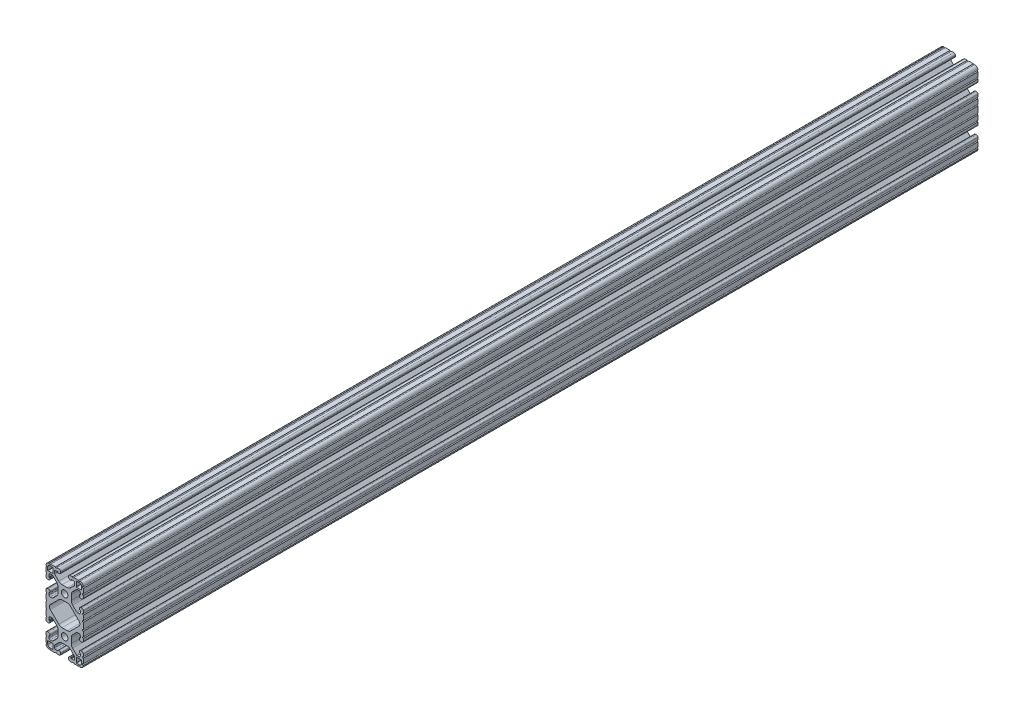
from build123d import *

# Parameters (mm, degrees)
SKETCH1_R           = 3.3274
BOSS_EXTRUDE1_DEPTH = 914.4


with BuildPart() as part:
    # Sketch1 → Boss-Extrude1 (new body)
    with BuildSketch(Plane(origin=(0, 0, -914.4), x_dir=(-1, 0, 0), z_dir=(0, 0, -1))):
        with BuildLine():
            Line((19.05, -14.3256), (19.05, -9.4996))
            ThreePointArc((19.05, -9.4996), (18.288, -8.7376), (19.05, -7.9756))
            Line((19.05, -7.9756), (19.05, -5.6388))
            ThreePointArc((19.05, -5.6388), (18.588751759, -4.525248241), (17.4752, -4.064))
            Line((17.4752, -4.064), (16.5608, -4.064))
            ThreePointArc((16.5608, -4.064), (15.447248241, -4.525248241), (14.986, -5.6388))
            Line((14.986, -5.6388), (14.986, -6.35))
            ThreePointArc((14.986, -6.35), (15.060394878, -6.529605122), (15.24, -6.604))
            Line((15.24, -6.604), (15.7099, -6.604))
            ThreePointArc((15.7099, -6.604), (15.889505122, -6.678394878), (15.9639, -6.858))
            Line((15.9639, -6.858), (15.9639, -9.017))
            ThreePointArc((15.9639, -9.017), (15.591925612, -9.915025612), (14.6939, -10.287))
            Line((14.6939, -10.287), (12.968312693, -10.287))
            ThreePointArc((12.968312693, -10.287), (12.482304734, -10.190327006), (12.070287081, -9.915025612))
            Line((12.070287081, -9.915025612), (8.147584211, -5.992322742))
            ThreePointArc((8.147584211, -5.992322742), (7.117956996, -4.451376719), (6.7564, -2.633706952))
            Line((6.7564, -2.633706952), (6.7564, 2.633706952))
            ThreePointArc((6.7564, 2.633706952), (7.117956996, 4.451376719), (8.147584211, 5.992322742))
            Line((8.147584211, 5.992322742), (12.070287081, 9.915025612))
            ThreePointArc((12.070287081, 9.915025612), (12.482304734, 10.190327006), (12.968312693, 10.287))
            Line((12.968312693, 10.287), (14.6939, 10.287))
            ThreePointArc((14.6939, 10.287), (15.591925612, 9.915025612), (15.9639, 9.017))
            Line((15.9639, 9.017), (15.9639, 6.858))
            ThreePointArc((15.9639, 6.858), (15.889505122, 6.678394878), (15.7099, 6.604))
            Line((15.7099, 6.604), (15.24, 6.604))
            ThreePointArc((15.24, 6.604), (15.060394878, 6.529605122), (14.986, 6.35))
            Line((14.986, 6.35), (14.986, 5.6388))
            ThreePointArc((14.986, 5.6388), (15.447248241, 4.525248241), (16.5608, 4.064))
            Line((16.5608, 4.064), (17.4752, 4.064))
            ThreePointArc((17.4752, 4.064), (18.588751759, 4.525248241), (19.05, 5.6388))
            Line((19.05, 5.6388), (19.05, 7.9756))
            ThreePointArc((19.05, 7.9756), (18.288, 8.7376), (19.05, 9.4996))
            Line((19.05, 9.4996), (19.05, 14.3256))
            ThreePointArc((19.05, 14.3256), (18.288, 15.0876), (19.05, 15.8496))
            Line((19.05, 15.8496), (19.05, 22.2504))
            ThreePointArc((19.05, 22.2504), (18.288, 23.0124), (19.05, 23.7744))
            Line((19.05, 23.7744), (19.05, 28.6004))
            ThreePointArc((19.05, 28.6004), (18.288, 29.3624), (19.05, 30.1244))
            Line((19.05, 30.1244), (19.05, 32.4612))
            ThreePointArc((19.05, 32.4612), (18.588751759, 33.574751759), (17.4752, 34.036))
            Line((17.4752, 34.036), (16.5608, 34.036))
            ThreePointArc((16.5608, 34.036), (15.447248241, 33.574751759), (14.986, 32.4612))
            Line((14.986, 32.4612), (14.986, 31.75))
            ThreePointArc((14.986, 31.75), (15.060394878, 31.570394878), (15.24, 31.496))
            Line((15.24, 31.496), (15.7099, 31.496))
            ThreePointArc((15.7099, 31.496), (15.889505122, 31.421605122), (15.9639, 31.242))
            Line((15.9639, 31.242), (15.9639, 29.083))
            ThreePointArc((15.9639, 29.083), (15.591925612, 28.184974388), (14.6939, 27.813))
            Line((14.6939, 27.813), (12.968312693, 27.813))
            ThreePointArc((12.968312693, 27.813), (12.482304734, 27.909672994), (12.070287081, 28.184974388))
            Line((12.070287081, 28.184974388), (8.147584211, 32.107677258))
            ThreePointArc((8.147584211, 32.107677258), (7.117956996, 33.648623281), (6.7564, 35.466293048))
            Line((6.7564, 35.466293048), (6.7564, 40.733706952))
            ThreePointArc((6.7564, 40.733706952), (7.117956996, 42.551376719), (8.147584211, 44.092322742))
            Line((8.147584211, 44.092322742), (12.070287081, 48.015025612))
            ThreePointArc((12.070287081, 48.015025612), (12.482304734, 48.290327006), (12.968312693, 48.387))
            Line((12.968312693, 48.387), (14.6939, 48.387))
            ThreePointArc((14.6939, 48.387), (15.591925612, 48.015025612), (15.9639, 47.117))
            Line((15.9639, 47.117), (15.9639, 44.958))
            ThreePointArc((15.9639, 44.958), (15.889505122, 44.778394878), (15.7099, 44.704))
            Line((15.7099, 44.704), (15.24, 44.704))
            ThreePointArc((15.24, 44.704), (15.060394878, 44.629605122), (14.986, 44.45))
            Line((14.986, 44.45), (14.986, 43.7388))
            ThreePointArc((14.986, 43.7388), (15.447248241, 42.625248241), (16.5608, 42.164))
            Line((16.5608, 42.164), (17.4752, 42.164))
            ThreePointArc((17.4752, 42.164), (18.588751759, 42.625248241), (19.05, 43.7388))
            Line((19.05, 43.7388), (19.05, 46.0756))
            ThreePointArc((19.05, 46.0756), (18.288, 46.8376), (19.05, 47.5996))
            Line((19.05, 47.5996), (19.05, 52.425599983))
            ThreePointArc((19.05, 52.425599983), (18.287999983, 53.187599965), (19.04999993, 53.949600017))
            ThreePointArc((19.04999993, 53.949600017), (18.120166371, 56.220166482), (15.849599896, 57.150000017))
            ThreePointArc((15.849599896, 57.150000017), (15.087599913, 56.388000034), (14.32559993, 57.150000017))
            Line((14.32559993, 57.150000017), (9.499599913, 57.150000017))
            ThreePointArc((9.499599913, 57.150000017), (8.737599913, 56.388000017), (7.975599913, 57.150000017))
            Line((7.975599913, 57.150000017), (5.638799984, 57.150000017))
            ThreePointArc((5.638799984, 57.150000017), (4.525248225, 56.688751776), (4.063999984, 55.575200017))
            Line((4.063999984, 55.575200017), (4.063999984, 54.6608))
            ThreePointArc((4.063999984, 54.6608), (4.525248225, 53.547248241), (5.638799984, 53.086))
            Line((5.638799984, 53.086), (6.35, 53.086))
            ThreePointArc((6.35, 53.086), (6.529605122, 53.160394878), (6.604, 53.34))
            Line((6.604, 53.34), (6.604, 53.8099))
            ThreePointArc((6.604, 53.8099), (6.678394878, 53.989505122), (6.858, 54.0639))
            Line((6.858, 54.0639), (9.017, 54.0639))
            ThreePointArc((9.017, 54.0639), (9.915025612, 53.691925612), (10.287, 52.7939))
            Line((10.287, 52.7939), (10.287, 51.068312693))
            ThreePointArc((10.287, 51.068312693), (10.190327006, 50.582304734), (9.915025612, 50.170287081))
            Line((9.915025612, 50.170287081), (5.992322742, 46.247584211))
            ThreePointArc((5.992322742, 46.247584211), (4.451376719, 45.217956996), (2.633706952, 44.8564))
            Line((2.633706952, 44.8564), (-2.633706952, 44.8564))
            ThreePointArc((-2.633706952, 44.8564), (-4.451376719, 45.217956996), (-5.992322742, 46.247584211))
            Line((-5.992322742, 46.247584211), (-9.915025612, 50.170287081))
            ThreePointArc((-9.915025612, 50.170287081), (-10.190327006, 50.582304734), (-10.287, 51.068312693))
            Line((-10.287, 51.068312693), (-10.287, 52.7939))
            ThreePointArc((-10.287, 52.7939), (-9.915025612, 53.691925612), (-9.017, 54.0639))
            Line((-9.017, 54.0639), (-6.858, 54.0639))
            ThreePointArc((-6.858, 54.0639), (-6.678394878, 53.989505122), (-6.604, 53.8099))
            Line((-6.604, 53.8099), (-6.604, 53.34))
            ThreePointArc((-6.604, 53.34), (-6.529605122, 53.160394878), (-6.35, 53.086))
            Line((-6.35, 53.086), (-5.638800016, 53.086))
            ThreePointArc((-5.638800016, 53.086), (-4.525248257, 53.547248241), (-4.064000016, 54.6608))
            Line((-4.064000016, 54.6608), (-4.064000016, 55.575200017))
            ThreePointArc((-4.064000016, 55.575200017), (-4.525248257, 56.688751776), (-5.638800016, 57.150000017))
            Line((-5.638800016, 57.150000017), (-7.975600087, 57.150000017))
            ThreePointArc((-7.975600087, 57.150000017), (-8.737600087, 56.388000017), (-9.499600087, 57.150000017))
            Line((-9.499600087, 57.150000017), (-14.325600087, 57.150000017))
            ThreePointArc((-14.325600087, 57.150000017), (-15.087600087, 56.388000017), (-15.849600087, 57.150000017))
            ThreePointArc((-15.849600087, 57.150000017), (-18.120166552, 56.220166458), (-19.050000087, 53.949599983))
            ThreePointArc((-19.050000087, 53.949599983), (-18.288000017, 53.187600043), (-19.05, 52.425600017))
            Line((-19.05, 52.425600017), (-19.05, 47.5996))
            ThreePointArc((-19.05, 47.5996), (-18.288, 46.8376), (-19.05, 46.0756))
            Line((-19.05, 46.0756), (-19.05, 43.7388))
            ThreePointArc((-19.05, 43.7388), (-18.588751759, 42.625248241), (-17.4752, 42.164))
            Line((-17.4752, 42.164), (-16.5608, 42.164))
            ThreePointArc((-16.5608, 42.164), (-15.447248241, 42.625248241), (-14.986, 43.7388))
            Line((-14.986, 43.7388), (-14.986, 44.45))
            ThreePointArc((-14.986, 44.45), (-15.060394878, 44.629605122), (-15.24, 44.704))
            Line((-15.24, 44.704), (-15.7099, 44.704))
            ThreePointArc((-15.7099, 44.704), (-15.889505122, 44.778394878), (-15.9639, 44.958))
            Line((-15.9639, 44.958), (-15.9639, 47.117))
            ThreePointArc((-15.9639, 47.117), (-15.591925612, 48.015025612), (-14.6939, 48.387))
            Line((-14.6939, 48.387), (-12.968312693, 48.387))
            ThreePointArc((-12.968312693, 48.387), (-12.482304734, 48.290327006), (-12.070287081, 48.015025612))
            Line((-12.070287081, 48.015025612), (-8.147584211, 44.092322742))
            ThreePointArc((-8.147584211, 44.092322742), (-7.117956996, 42.551376719), (-6.7564, 40.733706952))
            Line((-6.7564, 40.733706952), (-6.7564, 35.466293048))
            ThreePointArc((-6.7564, 35.466293048), (-7.117956996, 33.648623281), (-8.147584211, 32.107677258))
            Line((-8.147584211, 32.107677258), (-12.070287081, 28.184974388))
            ThreePointArc((-12.070287081, 28.184974388), (-12.482304734, 27.909672994), (-12.968312693, 27.813))
            Line((-12.968312693, 27.813), (-14.6939, 27.813))
            ThreePointArc((-14.6939, 27.813), (-15.591925612, 28.184974388), (-15.9639, 29.083))
            Line((-15.9639, 29.083), (-15.9639, 31.242))
            ThreePointArc((-15.9639, 31.242), (-15.889505122, 31.421605122), (-15.7099, 31.496))
            Line((-15.7099, 31.496), (-15.24, 31.496))
            ThreePointArc((-15.24, 31.496), (-15.060394878, 31.570394878), (-14.986, 31.75))
            Line((-14.986, 31.75), (-14.986, 32.4612))
            ThreePointArc((-14.986, 32.4612), (-15.447248241, 33.574751759), (-16.5608, 34.036))
            Line((-16.5608, 34.036), (-17.4752, 34.036))
            ThreePointArc((-17.4752, 34.036), (-18.588751759, 33.574751759), (-19.05, 32.4612))
            Line((-19.05, 32.4612), (-19.05, 30.1244))
            ThreePointArc((-19.05, 30.1244), (-18.288, 29.3624), (-19.05, 28.6004))
            Line((-19.05, 28.6004), (-19.05, 23.7744))
            ThreePointArc((-19.05, 23.7744), (-18.288, 23.0124), (-19.05, 22.2504))
            Line((-19.05, 22.2504), (-19.05, 15.8496))
            ThreePointArc((-19.05, 15.8496), (-18.288, 15.0876), (-19.05, 14.3256))
            Line((-19.05, 14.3256), (-19.05, 9.4996))
            ThreePointArc((-19.05, 9.4996), (-18.288, 8.7376), (-19.05, 7.9756))
            Line((-19.05, 7.9756), (-19.05, 5.6388))
            ThreePointArc((-19.05, 5.6388), (-18.588751759, 4.525248241), (-17.4752, 4.064))
            Line((-17.4752, 4.064), (-16.5608, 4.064))
            ThreePointArc((-16.5608, 4.064), (-15.447248241, 4.525248241), (-14.986, 5.6388))
            Line((-14.986, 5.6388), (-14.986, 6.35))
            ThreePointArc((-14.986, 6.35), (-15.060394878, 6.529605122), (-15.24, 6.604))
            Line((-15.24, 6.604), (-15.7099, 6.604))
            ThreePointArc((-15.7099, 6.604), (-15.889505122, 6.678394878), (-15.9639, 6.858))
            Line((-15.9639, 6.858), (-15.9639, 9.017))
            ThreePointArc((-15.9639, 9.017), (-15.591925612, 9.915025612), (-14.6939, 10.287))
            Line((-14.6939, 10.287), (-12.968312693, 10.287))
            ThreePointArc((-12.968312693, 10.287), (-12.482304734, 10.190327006), (-12.070287081, 9.915025612))
            Line((-12.070287081, 9.915025612), (-8.147584211, 5.992322742))
            ThreePointArc((-8.147584211, 5.992322742), (-7.117956996, 4.451376719), (-6.7564, 2.633706952))
            Line((-6.7564, 2.633706952), (-6.7564, -2.633706952))
            ThreePointArc((-6.7564, -2.633706952), (-7.117956996, -4.451376719), (-8.147584211, -5.992322742))
            Line((-8.147584211, -5.992322742), (-12.070287081, -9.915025612))
            ThreePointArc((-12.070287081, -9.915025612), (-12.482304734, -10.190327006), (-12.968312693, -10.287))
            Line((-12.968312693, -10.287), (-14.6939, -10.287))
            ThreePointArc((-14.6939, -10.287), (-15.591925612, -9.915025612), (-15.9639, -9.017))
            Line((-15.9639, -9.017), (-15.9639, -6.858))
            ThreePointArc((-15.9639, -6.858), (-15.889505122, -6.678394878), (-15.7099, -6.604))
            Line((-15.7099, -6.604), (-15.24, -6.604))
            ThreePointArc((-15.24, -6.604), (-15.060394878, -6.529605122), (-14.986, -6.35))
            Line((-14.986, -6.35), (-14.986, -5.6388))
            ThreePointArc((-14.986, -5.6388), (-15.447248241, -4.525248241), (-16.5608, -4.064))
            Line((-16.5608, -4.064), (-17.4752, -4.064))
            ThreePointArc((-17.4752, -4.064), (-18.588751759, -4.525248241), (-19.05, -5.6388))
            Line((-19.05, -5.6388), (-19.05, -7.9756))
            ThreePointArc((-19.05, -7.9756), (-18.288, -8.7376), (-19.05, -9.4996))
            Line((-19.05, -9.4996), (-19.05, -14.3256))
            ThreePointArc((-19.05, -14.3256), (-18.288, -15.087600017), (-19.050000033, -15.8496))
            ThreePointArc((-19.050000033, -15.8496), (-18.120166474, -18.120166465), (-15.849599999, -19.05))
            ThreePointArc((-15.849599999, -19.05), (-15.087600016, -18.288000017), (-14.325600033, -19.05))
            Line((-14.325600033, -19.05), (-9.499600016, -19.05))
            ThreePointArc((-9.499600016, -19.05), (-8.737600016, -18.288), (-7.975600016, -19.05))
            Line((-7.975600016, -19.05), (-5.638800016, -19.05))
            ThreePointArc((-5.638800016, -19.05), (-4.525248257, -18.588751759), (-4.064000016, -17.4752))
            Line((-4.064000016, -17.4752), (-4.064000016, -16.5608))
            ThreePointArc((-4.064000016, -16.5608), (-4.525248257, -15.447248241), (-5.638800016, -14.986))
            Line((-5.638800016, -14.986), (-6.35, -14.986))
            ThreePointArc((-6.35, -14.986), (-6.529605122, -15.060394878), (-6.604, -15.24))
            Line((-6.604, -15.24), (-6.604, -15.7099))
            ThreePointArc((-6.604, -15.7099), (-6.678394878, -15.889505122), (-6.858, -15.9639))
            Line((-6.858, -15.9639), (-9.017, -15.9639))
            ThreePointArc((-9.017, -15.9639), (-9.915025612, -15.591925612), (-10.287, -14.6939))
            Line((-10.287, -14.6939), (-10.287, -12.968312693))
            ThreePointArc((-10.287, -12.968312693), (-10.190327006, -12.482304734), (-9.915025612, -12.070287081))
            Line((-9.915025612, -12.070287081), (-5.992322742, -8.147584211))
            ThreePointArc((-5.992322742, -8.147584211), (-4.451376719, -7.117956996), (-2.633706952, -6.7564))
            Line((-2.633706952, -6.7564), (2.633706952, -6.7564))
            ThreePointArc((2.633706952, -6.7564), (4.451376719, -7.117956996), (5.992322742, -8.147584211))
            Line((5.992322742, -8.147584211), (9.915025612, -12.070287081))
            ThreePointArc((9.915025612, -12.070287081), (10.190327006, -12.482304734), (10.287, -12.968312693))
            Line((10.287, -12.968312693), (10.287, -14.6939))
            ThreePointArc((10.287, -14.6939), (9.915025612, -15.591925612), (9.017, -15.9639))
            Line((9.017, -15.9639), (6.858, -15.9639))
            ThreePointArc((6.858, -15.9639), (6.678394878, -15.889505122), (6.604, -15.7099))
            Line((6.604, -15.7099), (6.604, -15.24))
            ThreePointArc((6.604, -15.24), (6.529605122, -15.060394878), (6.35, -14.986))
            Line((6.35, -14.986), (5.638799984, -14.986))
            ThreePointArc((5.638799984, -14.986), (4.525248225, -15.447248241), (4.063999984, -16.5608))
            Line((4.063999984, -16.5608), (4.063999984, -17.4752))
            ThreePointArc((4.063999984, -17.4752), (4.525248225, -18.588751759), (5.638799984, -19.05))
            Line((5.638799984, -19.05), (7.975599984, -19.05))
            ThreePointArc((7.975599984, -19.05), (8.737599984, -18.288), (9.499599984, -19.05))
            Line((9.499599984, -19.05), (14.325599984, -19.05))
            ThreePointArc((14.325599984, -19.05), (15.087599984, -18.288), (15.849599984, -19.05))
            ThreePointArc((15.849599984, -19.05), (18.120166437, -18.120166453), (19.049999984, -15.8496))
            ThreePointArc((19.049999984, -15.8496), (18.288, -15.087599992), (19.05, -14.3256))
        make_face()
        with Locations(Location((0, 0, 0), (0, 0, 180))):
            Circle(SKETCH1_R, mode=Mode.SUBTRACT)
        with Locations(Location((0, 38.1, 0), (0, 0, 180))):
            Circle(SKETCH1_R, mode=Mode.SUBTRACT)
        with BuildLine():
            Line((-11.8872, -12.1412), (-11.8872, -17.018))
            ThreePointArc((-11.8872, -17.018), (-11.961594878, -17.197605122), (-12.1412, -17.272))
            Line((-12.1412, -17.272), (-15.1384, -17.272))
            ThreePointArc((-15.1384, -17.272), (-16.647083028, -16.647083028), (-17.272, -15.1384))
            Line((-17.272, -15.1384), (-17.272, -12.1412))
            ThreePointArc((-17.272, -12.1412), (-17.197605122, -11.961594878), (-17.018, -11.8872))
            Line((-17.018, -11.8872), (-12.1412, -11.8872))
            ThreePointArc((-12.1412, -11.8872), (-11.961594878, -11.961594878), (-11.8872, -12.1412))
        make_face(mode=Mode.SUBTRACT)
        with BuildLine():
            Line((-15.1384, 55.372), (-12.1412, 55.372))
            ThreePointArc((-12.1412, 55.372), (-11.961594878, 55.297605122), (-11.8872, 55.118))
            Line((-11.8872, 55.118), (-11.8872, 50.2412))
            ThreePointArc((-11.8872, 50.2412), (-11.961594878, 50.061594878), (-12.1412, 49.9872))
            Line((-12.1412, 49.9872), (-17.018, 49.9872))
            ThreePointArc((-17.018, 49.9872), (-17.197605122, 50.061594878), (-17.272, 50.2412))
            Line((-17.272, 50.2412), (-17.272, 53.2384))
            ThreePointArc((-17.272, 53.2384), (-16.647083028, 54.747083028), (-15.1384, 55.372))
        make_face(mode=Mode.SUBTRACT)
        with BuildLine():
            Line((5.992322742, 29.952415789), (14.618886052, 21.325852479))
            ThreePointArc((14.618886052, 21.325852479), (15.561575015, 19.05), (14.618886052, 16.774147521))
            Line((14.618886052, 16.774147521), (5.992322742, 8.147584211))
            ThreePointArc((5.992322742, 8.147584211), (4.451376719, 7.117956996), (2.633706952, 6.7564))
            Line((2.633706952, 6.7564), (-2.633706952, 6.7564))
            ThreePointArc((-2.633706952, 6.7564), (-4.451376719, 7.117956996), (-5.992322742, 8.147584211))
            Line((-5.992322742, 8.147584211), (-14.618886052, 16.774147521))
            ThreePointArc((-14.618886052, 16.774147521), (-15.561575015, 19.05), (-14.618886052, 21.325852479))
            Line((-14.618886052, 21.325852479), (-5.992322742, 29.952415789))
            ThreePointArc((-5.992322742, 29.952415789), (-4.451376719, 30.982043004), (-2.633706952, 31.3436))
            Line((-2.633706952, 31.3436), (2.633706952, 31.3436))
            ThreePointArc((2.633706952, 31.3436), (4.451376719, 30.982043004), (5.992322742, 29.952415789))
        make_face(mode=Mode.SUBTRACT)
        with BuildLine():
            Line((17.272, -12.1412), (17.272, -15.1384))
            ThreePointArc((17.272, -15.1384), (16.647083028, -16.647083028), (15.1384, -17.272))
            Line((15.1384, -17.272), (12.1412, -17.272))
            ThreePointArc((12.1412, -17.272), (11.961594878, -17.197605122), (11.8872, -17.018))
            Line((11.8872, -17.018), (11.8872, -12.1412))
            ThreePointArc((11.8872, -12.1412), (11.961594878, -11.961594878), (12.1412, -11.8872))
            Line((12.1412, -11.8872), (17.018, -11.8872))
            ThreePointArc((17.018, -11.8872), (17.197605122, -11.961594878), (17.272, -12.1412))
        make_face(mode=Mode.SUBTRACT)
        with BuildLine():
            Line((12.1412, 55.372), (15.1384, 55.372))
            ThreePointArc((15.1384, 55.372), (16.647083028, 54.747083028), (17.272, 53.2384))
            Line((17.272, 53.2384), (17.272, 50.2412))
            ThreePointArc((17.272, 50.2412), (17.197605122, 50.061594878), (17.018, 49.9872))
            Line((17.018, 49.9872), (12.1412, 49.9872))
            ThreePointArc((12.1412, 49.9872), (11.961594878, 50.061594878), (11.8872, 50.2412))
            Line((11.8872, 50.2412), (11.8872, 55.118))
            ThreePointArc((11.8872, 55.118), (11.961594878, 55.297605122), (12.1412, 55.372))
        make_face(mode=Mode.SUBTRACT)
    extrude(amount=-BOSS_EXTRUDE1_DEPTH)


solid = part.part
